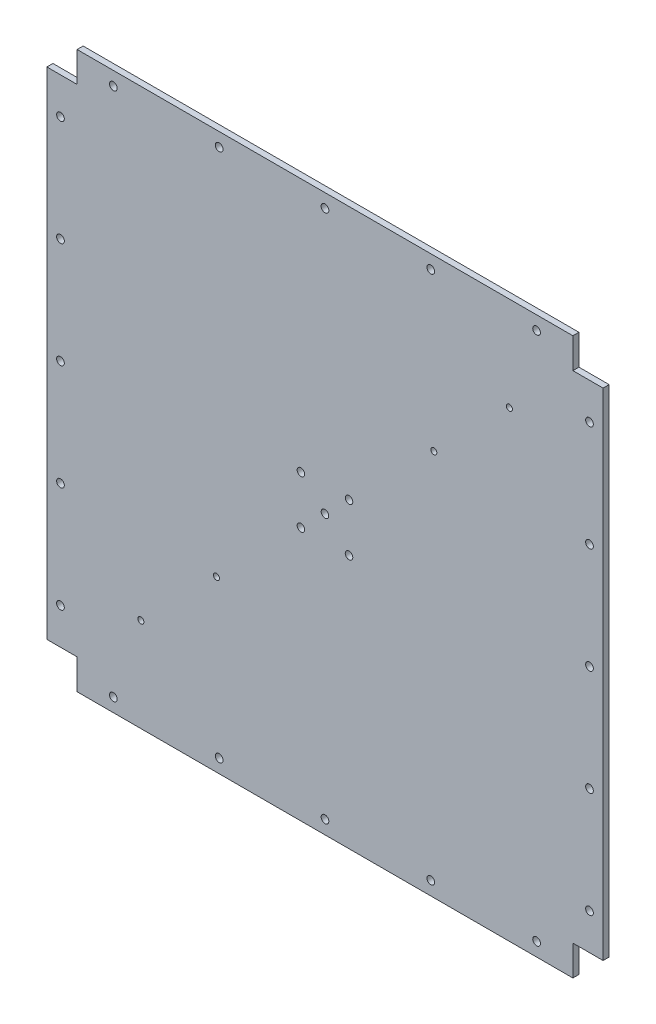
from build123d import *

# Parameters (mm, degrees)
SKETCH_1_W          = 368
SKETCH_1_H          = 368
EXTRUDE_1_DEPTH     = 4
SKETCH_3_R          = 2.55
CUT_EXTRUDE_2_DEPTH = 261.246037434
SKETCH_4_W          = 20
SKETCH_4_H          = 20
CUT_EXTRUDE_3_DEPTH = 261.246037434
SKETCH_5_R          = 2.5
CUT_EXTRUDE_6_DEPTH = 10
SKETCH_6_R          = 2
CUT_EXTRUDE_7_DEPTH = 10


with BuildPart() as part:
    # 草图1 → 凸台-拉伸1 (new body)
    with BuildSketch(Plane.XY):
        Rectangle(SKETCH_1_W, SKETCH_1_H)
    extrude(amount=EXTRUDE_1_DEPTH)

    # 草图3 → 切除-拉伸2 (cut, through all)
    with BuildSketch(Plane.XY.offset(4)):
        with Locations((0, -175)):
            Circle(SKETCH_3_R)
        with Locations((70, -175)):
            Circle(SKETCH_3_R)
        with Locations((140, -175)):
            Circle(SKETCH_3_R)
        with Locations((-70, -175)):
            Circle(SKETCH_3_R)
        with Locations((-140, -175)):
            Circle(SKETCH_3_R)
        with Locations((-175, 140)):
            Circle(SKETCH_3_R)
        with Locations((-175, 70)):
            Circle(SKETCH_3_R)
        with Locations((-175, -70)):
            Circle(SKETCH_3_R)
        with Locations((-175, -140)):
            Circle(SKETCH_3_R)
        with Locations((-175, 0)):
            Circle(SKETCH_3_R)
        with Locations((140, 175)):
            Circle(SKETCH_3_R)
        with Locations((70, 175)):
            Circle(SKETCH_3_R)
        with Locations((-70, 175)):
            Circle(SKETCH_3_R)
        with Locations((-140, 175)):
            Circle(SKETCH_3_R)
        with Locations((0, 175)):
            Circle(SKETCH_3_R)
        with Locations((175, -140)):
            Circle(SKETCH_3_R)
        with Locations((175, -70)):
            Circle(SKETCH_3_R)
        with Locations((175, 70)):
            Circle(SKETCH_3_R)
        with Locations((175, 140)):
            Circle(SKETCH_3_R)
        with Locations((175, 0)):
            Circle(SKETCH_3_R)
    extrude(amount=-CUT_EXTRUDE_2_DEPTH, mode=Mode.SUBTRACT)

    # 草图4 → 切除-拉伸3 (cut, through all)
    with BuildSketch(Plane.XY.offset(4)):
        with Locations((-174, 174)):
            Rectangle(SKETCH_4_W, SKETCH_4_H)
        with Locations((-174, -174)):
            Rectangle(SKETCH_4_W, SKETCH_4_H)
        with Locations((174, 174)):
            Rectangle(SKETCH_4_W, SKETCH_4_H)
        with Locations((174, -174)):
            Rectangle(SKETCH_4_W, SKETCH_4_H)
    extrude(amount=-CUT_EXTRUDE_3_DEPTH, mode=Mode.SUBTRACT)

    # 草图5 → 切除-拉伸6 (cut)
    with BuildSketch(Plane.XY.offset(4)):
        Circle(SKETCH_5_R)
        with Locations((-15.909902577, 15.909902577)):
            Circle(SKETCH_5_R)
        with Locations((15.909902577, 15.909902577)):
            Circle(SKETCH_5_R)
        with Locations((15.909902577, -15.909902577)):
            Circle(SKETCH_5_R)
        with Locations((-15.909902577, -15.909902577)):
            Circle(SKETCH_5_R)
    extrude(amount=-CUT_EXTRUDE_6_DEPTH, mode=Mode.SUBTRACT)

    # 草图6 → 切除-拉伸7 (cut)
    with BuildSketch(Plane(origin=(0, 0, 0), x_dir=(-1, 0, 0), z_dir=(0, 0, -1))):
        with Locations((121.8, -122)):
            Circle(SKETCH_6_R)
        with Locations((71.8, -72)):
            Circle(SKETCH_6_R)
        with Locations(Location((-122, 121.8, 0), (0, 0, 180))):
            Circle(SKETCH_6_R)
        with Locations(Location((-72, 71.8, 0), (0, 0, 180))):
            Circle(SKETCH_6_R)
    extrude(amount=-CUT_EXTRUDE_7_DEPTH, mode=Mode.SUBTRACT)


solid = part.part
